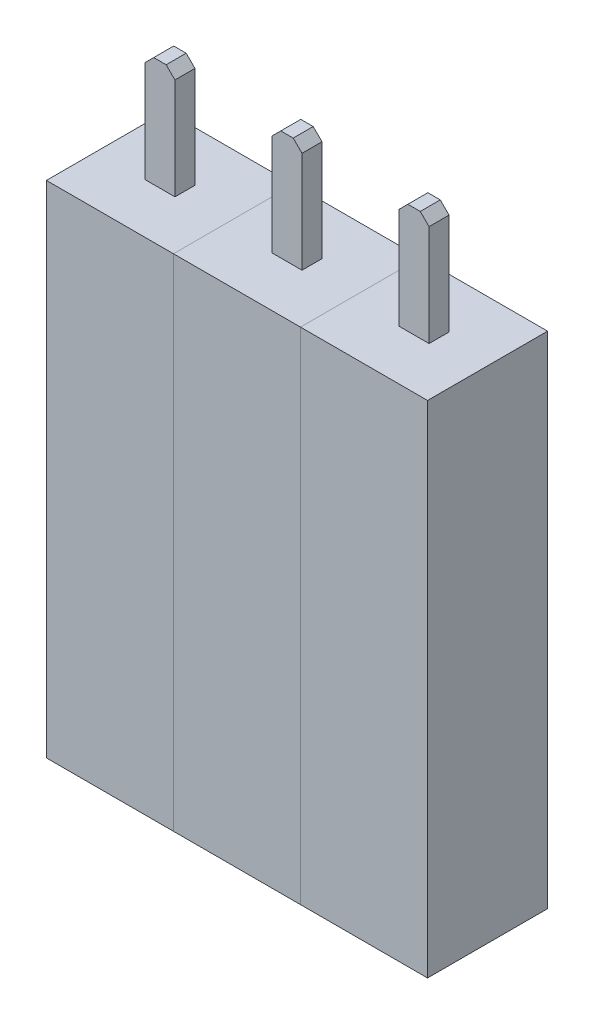
from build123d import *

# Parameters (mm, degrees)
SKETCH1_W           = 2.54
SKETCH1_H           = 10
BOSS_EXTRUDE1_DEPTH = 1.2
SKETCH2_W           = 1.2
SKETCH2_H           = 1.2
CUT_EXTRUDE1_DEPTH  = 7
BOSS_EXTRUDE2_DEPTH = 0.2
LPATTERN1_COUNT     = 3
LPATTERN1_PITCH     = 2.54


with BuildPart() as part:
    # Sketch1 → Boss-Extrude1 (new, symmetric)
    with BuildSketch(Plane.XY):
        Rectangle(SKETCH1_W, SKETCH1_H)
    extrude(amount=BOSS_EXTRUDE1_DEPTH, both=True)

    # Sketch2 → Cut-Extrude1 (cut)
    with BuildSketch(Plane.XZ.offset(5)):
        Rectangle(SKETCH2_W, SKETCH2_H)
    extrude(amount=-CUT_EXTRUDE1_DEPTH, mode=Mode.SUBTRACT)

    # Sketch3 → Boss-Extrude2 (add, symmetric)
    with BuildSketch(Plane.XY):
        Polygon((-0.3, 5), (-0.3, 7.024264069), (-0.124264069, 7.2), (0.124264069, 7.2), (0.3, 7.024264069), (0.3, 5), align=None)
    extrude(amount=BOSS_EXTRUDE2_DEPTH, both=True)


with BuildPart() as lpattern1_1:
    # LPattern1: pattern copy
    add(part.part.moved(Location(Vector(1, 0, 0) * (1 * LPATTERN1_PITCH))))


with BuildPart() as lpattern1_2:
    # LPattern1: pattern copy
    add(part.part.moved(Location(Vector(1, 0, 0) * (2 * LPATTERN1_PITCH))))


solid = Compound([part.part, lpattern1_1.part, lpattern1_2.part])
